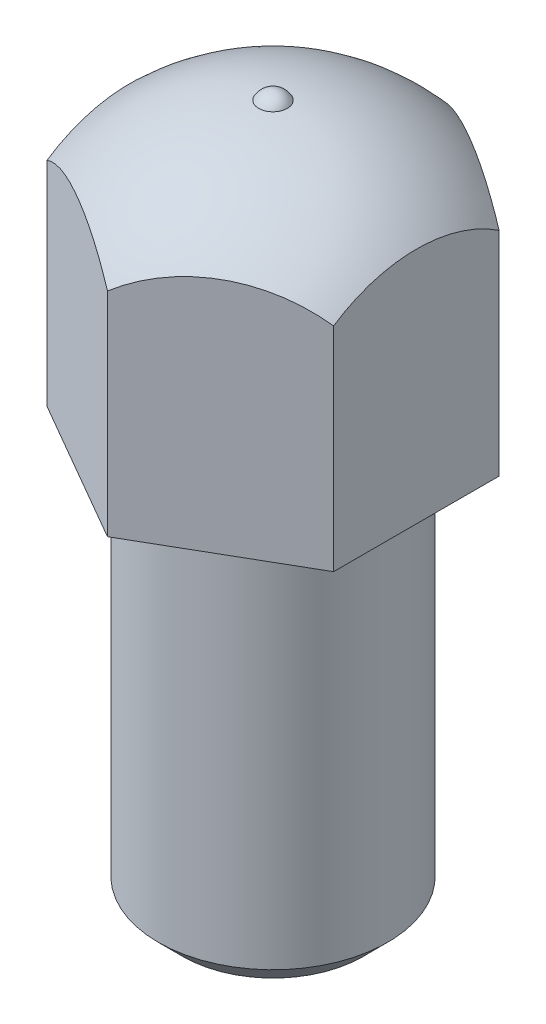
from build123d import *

# Parameters (mm, degrees)
SKETCH_2_R          = 5
CUT_EXTRUDE_1_DEPTH = 5.3


with BuildPart() as part:
    # Эскиз1 → Повернуть1 (revolve)
    with BuildSketch(Plane.XY, mode=Mode.PRIVATE) as revolve_1_sk:
        with BuildLine():
            Line((3, 3.550626861), (3, 0))
            Line((3, 0), (2, 0))
            Line((2, 0), (2, -6.5705))
            Line((2, -6.5705), (1.5705, -7))
            Line((1.5705, -7), (0, -7))
            Line((0, -7), (0, 5.3))
            ThreePointArc((0, 5.3), (0.145773797, 5.259622996), (0.25, 5.15))
            ThreePointArc((0.25, 5.15), (1.811111153, 4.670317349), (3, 3.550626861))
        make_face()
    revolve(revolve_1_sk.sketch.rotate(Axis((0, -7, 0), (0, 1, 0)), 270), axis=Axis((0, -7, 0), (0, 1, 0)))

    # Эскиз2 → Вырез-Вытянуть1 (cut)
    with BuildSketch(Plane(origin=(0, 0, 0), x_dir=(1, 0, 0), z_dir=(0, 1, 0))):
        Circle(SKETCH_2_R)
        Polygon((-2.5, 1.443375673), (-2.5, -1.443375673), (0, -2.886751346), (2.5, -1.443375673), (2.5, 1.443375673), (0, 2.886751346), align=None, mode=Mode.SUBTRACT)
    extrude(amount=CUT_EXTRUDE_1_DEPTH, mode=Mode.SUBTRACT)


solid = part.part
